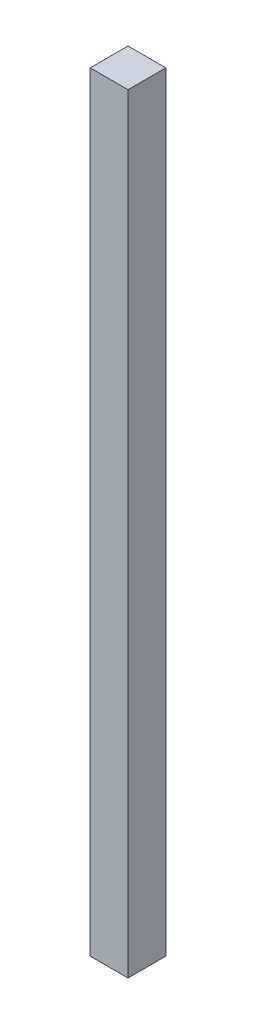
from build123d import *

# Parameters (mm, degrees)
SKETCH1_W           = 15
SKETCH1_H           = 15
BOSS_EXTRUDE1_DEPTH = 304.8


with BuildPart() as part:
    # Sketch1 → Boss-Extrude1 (new body)
    with BuildSketch(Plane(origin=(0, 0, 0), x_dir=(1, 0, 0), z_dir=(0, 1, 0))):
        Rectangle(SKETCH1_W, SKETCH1_H)
    extrude(amount=BOSS_EXTRUDE1_DEPTH)


solid = part.part
